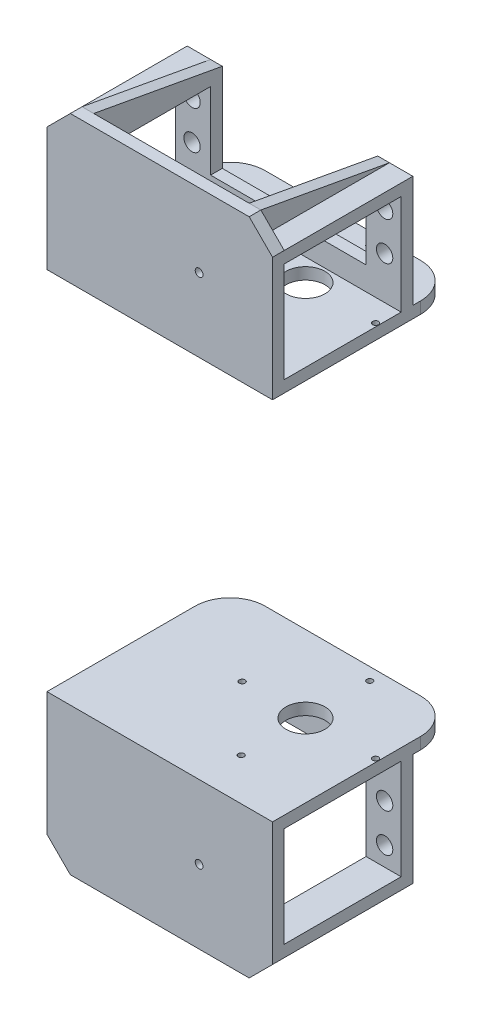
from build123d import *

# Parameters (mm, degrees)
SKETCH_1_W          = 57.9
SKETCH_1_H          = 37.7
SKETCH_1_R          = 2.1
SKETCH_1_W_2        = 39.9
SKETCH_1_H_2        = 19.7
EXTRUDE_1_DEPTH     = 3
SKETCH_2_W          = 57.9
SKETCH_2_H          = 3
EXTRUDE_2_DEPTH     = 30
SKETCH_3_R          = 1
EXTRUDE_3_DEPTH     = 3
SKETCH_9_W          = 57.9
SKETCH_9_H          = 3
EXTRUDE_4_DEPTH     = 11
SKETCH_10_R         = 0.75
SKETCH_10_R_2       = 5
CUT_EXTRUDE_3_DEPTH = 3
SKETCH_11_W         = 9
SKETCH_11_H         = 3
EXTRUDE_5_DEPTH     = 32
CUT_EXTRUDE_4_DEPTH = 9
EXTRUDE_6_DEPTH     = 3
SKETCH_17_W         = 3
SKETCH_17_H         = 33
EXTRUDE_7_DEPTH     = 6
CUT_EXTRUDE_5_DEPTH = 52


with BuildPart() as part:
    # 草图1 → 凸台-拉伸1 (new body)
    with BuildSketch(Plane.XY):
        with Locations((5.239385195, 7.436956636)):
            Rectangle(SKETCH_1_W, SKETCH_1_H)
        with Locations((-19.470614805, 12.356956636)):
            Circle(SKETCH_1_R, mode=Mode.SUBTRACT)
        with Locations((-19.470614805, 2.516956636)):
            Circle(SKETCH_1_R, mode=Mode.SUBTRACT)
        with Locations((29.949385195, 12.356956636)):
            Circle(SKETCH_1_R, mode=Mode.SUBTRACT)
        with Locations((29.949385195, 2.516956636)):
            Circle(SKETCH_1_R, mode=Mode.SUBTRACT)
        with Locations((5.239385195, 7.436956636)):
            Rectangle(SKETCH_1_W_2, SKETCH_1_H_2, mode=Mode.SUBTRACT)
    extrude(amount=EXTRUDE_1_DEPTH)

    # 草图2 → 凸台-拉伸2 (add)
    with BuildSketch(Plane.XY.offset(3)):
        with Locations((5.239385195, 24.786956636)):
            Rectangle(SKETCH_2_W, SKETCH_2_H)
    extrude(amount=EXTRUDE_2_DEPTH)

    # 草图3 → 凸台-拉伸3 (add)
    with BuildSketch(Plane.XY.offset(33)):
        Polygon((-14.710614805, 26.286956636), (-23.710614805, 26.286956636), (-23.710614805, -2.413043364), (-23.710614805, -5.413043364), (34.189385195, -5.413043364), (34.189385195, -2.413043364), (34.189385195, 26.286956636), (25.189385195, 26.286956636), align=None)
        with Locations((15.339385195, 7.436956636)):
            Circle(SKETCH_3_R, mode=Mode.SUBTRACT)
    extrude(amount=EXTRUDE_3_DEPTH)

    # 草图9 → 凸台-拉伸4 (add)
    with BuildSketch(Plane(origin=(0, 0, 0), x_dir=(-1, 0, 0), z_dir=(0, 0, -1))):
        with Locations((-5.239385195, 24.786956636)):
            Rectangle(SKETCH_9_W, SKETCH_9_H)
    extrude(amount=EXTRUDE_4_DEPTH)

    # 草图10 → 切除-拉伸3 (cut)
    with BuildSketch(Plane(origin=(0, 26.286956636, 0), x_dir=(1, 0, 0), z_dir=(0, 1, 0))):
        with Locations(Location((15.339385195, 7.8, 0), (0, 0, 270))):
            Circle(SKETCH_10_R)
        with Locations(Location((33.339385195, -8.7, 0), (0, 0, 270))):
            Circle(SKETCH_10_R)
        with Locations(Location((15.339385195, -25.2, 0), (0, 0, 270))):
            Circle(SKETCH_10_R)
        with Locations(Location((-0.910614805, -8.7, 0), (0, 0, 270))):
            Circle(SKETCH_10_R)
        with Locations(Location((15.339385195, -8.7, 0), (0, 0, 270))):
            Circle(SKETCH_10_R_2)
        with BuildLine():
            Line((-23.710614805, 2), (-23.710614805, 11))
            Line((-23.710614805, 11), (-14.710614805, 11))
            ThreePointArc((-14.710614805, 11), (-21.074575836, 8.363961031), (-23.710614805, 2))
        make_face()
        with BuildLine():
            Line((25.189385195, 11), (34.189385195, 11))
            Line((34.189385195, 11), (34.189385195, 2))
            ThreePointArc((34.189385195, 2), (31.553346226, 8.363961031), (25.189385195, 11))
        make_face()
    extrude(amount=-CUT_EXTRUDE_3_DEPTH, mode=Mode.SUBTRACT)


with BuildPart() as body_2:
    # 镜向1: mirrored copy
    add(part.part.mirror(Plane.ZX.offset(73.186956636)))


with BuildPart() as part_1:
    add(part.part)

    # 草图11 → 凸台-拉伸5 (add)
    with BuildSketch(Plane(origin=(0, 0, 33), x_dir=(-1, 0, 0), z_dir=(0, 0, -1))):
        with Locations((19.210614805, -3.913043364)):
            Rectangle(SKETCH_11_W, SKETCH_11_H)
        with Locations((-29.689385195, -3.913043364)):
            Rectangle(SKETCH_11_W, SKETCH_11_H)
    extrude(amount=EXTRUDE_5_DEPTH)

    # 草图12 → 切除-拉伸4 (cut)
    with BuildSketch(Plane(origin=(0, 0, 0), x_dir=(-1, 0, 0), z_dir=(0, 0, -1))):
        Polygon((-25.189385195, -2.413043364), (-25.189385195, -5.413043364), (-34.189385195, -5.413043364), (-34.189385195, -11.413043364), (23.710614805, -11.413043364), (23.710614805, -5.413043364), (14.710614805, -5.413043364), (14.710614805, -2.413043364), align=None)
    extrude(amount=-CUT_EXTRUDE_4_DEPTH, mode=Mode.SUBTRACT)

    # 草图13 → 凸台-拉伸6 (add)
    with BuildSketch(Plane.XY.offset(36)):
        Polygon((-23.710614805, -5.413043364), (34.189385195, -5.413043364), (28.189385195, -11.413043364), (-17.710614805, -11.413043364), align=None)
    extrude(amount=-EXTRUDE_6_DEPTH)

    # 草图17 → 凸台-拉伸7 (add)
    with BuildSketch(Plane.XZ.offset(5.413043364)):
        with Locations((-16.210614805, 16.5)):
            Rectangle(SKETCH_17_W, SKETCH_17_H)
        with Locations((26.689385195, 16.5)):
            Rectangle(SKETCH_17_W, SKETCH_17_H)
    extrude(amount=EXTRUDE_7_DEPTH)

    # 草图19 → 切除-拉伸5 (cut)
    with BuildSketch(Plane.ZY.offset(17.710614805)):
        Polygon((0, -5.413043364), (0, -11.413043364), (33, -11.413043364), align=None)
    extrude(amount=-CUT_EXTRUDE_5_DEPTH, mode=Mode.SUBTRACT)


with BuildPart() as body_2_2:
    # 镜向2: mirrored copy
    add(part_1.part.mirror(Plane.ZX.offset(73.186956636)))


solid = Compound([part_1.part, body_2_2.part])
